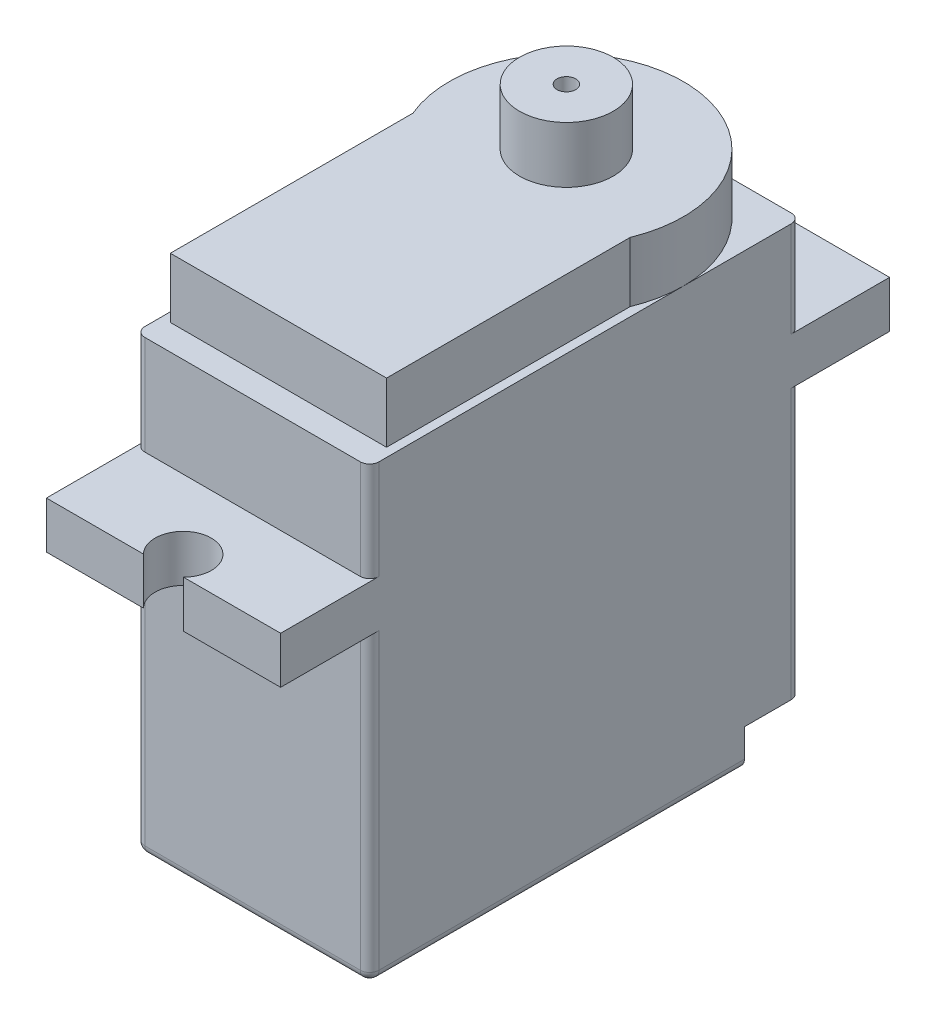
from build123d import *

# Parameters (mm, degrees)
SKETCH1_W               = 12.5
SKETCH1_H               = 23
BOSS_EXTRUDE1_DEPTH     = 24
BOSS_EXTRUDE2_DEPTH     = 3.2
SKETCH3_R               = 2.5
SKETCH3_R_2             = 0.5
BOSS_EXTRUDE3_DEPTH     = 3
SKETCH4_W               = 12.5
SKETCH4_H               = 2.5
BOSS_EXTRUDE4_DEPTH     = 4.75
SKETCH5_W               = 12.5
SKETCH5_H               = 2.5
BOSS_EXTRUDE5_DEPTH     = 4.75
CUT_EXTRUDE1_REACH      = 27.55
SKETCH6_R               = 1.5
CUT_EXTRUDE2_REACH      = 27.697
SKETCH8_R               = 1.5
CUT_EXTRUDE4_DEPTH      = 37.501404083
CUT_EXTRUDE6_DEPTH      = 37.501404083
CUT_EXTRUDE6_DEPTH_BACK = 2.3
CUT_EXTRUDE7_DEPTH      = 37.501404083
CUT_EXTRUDE7_DEPTH_BACK = 2.3
FILLET1_R               = 0.5


with BuildPart() as part:
    # Sketch1 → Boss-Extrude1 (new body)
    with BuildSketch(Plane(origin=(0, 0, 0), x_dir=(1, 0, 0), z_dir=(0, 1, 0))):
        Rectangle(SKETCH1_W, SKETCH1_H)
    extrude(amount=BOSS_EXTRUDE1_DEPTH)

    # Sketch2 → Boss-Extrude2 (add)
    with BuildSketch(Plane(origin=(0, 24, 0), x_dir=(1, 0, 0), z_dir=(0, 1, 0))):
        with BuildLine():
            Line((-5.757621024, 2.818477812), (-5.757621024, -10.12881992))
            Line((-5.757621024, -10.12881992), (5.781688552, -10.12881992))
            Line((5.781688552, -10.12881992), (5.781688552, 2.876273501))
            ThreePointArc((5.781688552, 2.876273501), (-0.031303305, 11.499921608), (-5.757621024, 2.818477812))
        make_face()
    extrude(amount=BOSS_EXTRUDE2_DEPTH)

    # Sketch3 → Boss-Extrude3 (add)
    with BuildSketch(Plane(origin=(0, 27.2, 0), x_dir=(1, 0, 0), z_dir=(0, 1, 0))):
        with Locations(Location((0, 5.25, 0), (0, 0, 270))):
            Circle(SKETCH3_R)
        with Locations(Location((0, 5.25, 0), (0, 0, 270))):
            Circle(SKETCH3_R_2, mode=Mode.SUBTRACT)
    extrude(amount=BOSS_EXTRUDE3_DEPTH)

    # Sketch4 → Boss-Extrude4 (add)
    with BuildSketch(Plane(origin=(0, 0, -11.5), x_dir=(-1, 0, 0), z_dir=(0, 0, -1))):
        with Locations((0, 17.65)):
            Rectangle(SKETCH4_W, SKETCH4_H)
    extrude(amount=BOSS_EXTRUDE4_DEPTH)

    # Sketch5 → Boss-Extrude5 (add)
    with BuildSketch(Plane.XY.offset(11.5)):
        with Locations((0, 17.45)):
            Rectangle(SKETCH5_W, SKETCH5_H)
    extrude(amount=BOSS_EXTRUDE5_DEPTH)

    # Sketch6 → Cut-Extrude1 (cut, up to next)
    with BuildSketch(Plane(origin=(0, 18.7, 0), x_dir=(1, 0, 0), z_dir=(0, 1, 0)), mode=Mode.PRIVATE) as cut_extrude1_sk1:
        with Locations((0, -15.2)):
            Circle(SKETCH6_R)
    cut_extrude1_tool1 = extrude(cut_extrude1_sk1.sketch, amount=-CUT_EXTRUDE1_REACH, mode=Mode.PRIVATE) & part.part
    add(cut_extrude1_tool1.solids().sort_by_distance((0, 18.7, 15.2))[0], mode=Mode.SUBTRACT)

    # Sketch8 → Cut-Extrude2 (cut, up to next)
    with BuildSketch(Plane(origin=(0, 18.9, 0), x_dir=(1, 0, 0), z_dir=(0, 1, 0)), mode=Mode.PRIVATE) as cut_extrude2_sk1:
        with Locations((0, 15.2)):
            Circle(SKETCH8_R)
    cut_extrude2_tool1 = extrude(cut_extrude2_sk1.sketch, amount=-CUT_EXTRUDE2_REACH, mode=Mode.PRIVATE) & part.part
    add(cut_extrude2_tool1.solids().sort_by_distance((0, 18.9, -15.2))[0], mode=Mode.SUBTRACT)

    # Sketch9 → Cut-Extrude4 (cut, through all)
    with BuildSketch(Plane(origin=(6.25, 0, 0), x_dir=(0, 0, -1), z_dir=(1, 0, 0))):
        Polygon((11.5, 2), (8.5, 0), (11.5, 0), align=None)
    extrude(amount=-CUT_EXTRUDE4_DEPTH, mode=Mode.SUBTRACT)

    # Sketch10 → Cut-Extrude6 (cut, two sides: drawn at the far end of the back side and taken through both)
    with BuildSketch(Plane(origin=(6.25, 0, 0), x_dir=(0, 0, -1), z_dir=(1, 0, 0)).offset(-CUT_EXTRUDE6_DEPTH_BACK)):
        Polygon((100.627808007, 2), (11.5, 2), (8.5, 2), (8.5, 0), (8.5, -89.127808007), (133.856074627, -215.859489897), (225.983882634, -124.73168189), align=None)
    extrude(amount=CUT_EXTRUDE6_DEPTH + CUT_EXTRUDE6_DEPTH_BACK, mode=Mode.SUBTRACT)

    # Sketch11 → Cut-Extrude7 (cut, two sides: drawn at the far end of the back side and taken through both)
    with BuildSketch(Plane.ZY.offset(6.25).offset(-CUT_EXTRUDE7_DEPTH_BACK)):
        Polygon((-100.627808007, 2), (-11.5, 2), (-8.5, 2), (-8.5, 0), (-8.5, -89.127808007), (-133.856074627, -215.859489897), (-225.983882634, -124.73168189), align=None)
    extrude(amount=CUT_EXTRUDE7_DEPTH + CUT_EXTRUDE7_DEPTH_BACK, mode=Mode.SUBTRACT)

    # Fillet1
    fillet1_edges = [part.edges().sort_by_distance(p)[0] for p in [
        (-6.25, 9.2, -11.5),
        (6.25, 9.2, -11.5),
        (6.25, 0, 1.5),
        (6.25, 8.1, 11.5),
        (-6.25, 8.1, 11.5),
        (0, 0, 11.5),
        (-6.25, 21.45, -11.5),
        (6.25, 21.45, -11.5),
        (6.25, 21.35, 11.5),
        (-6.25, 21.35, 11.5),
        (-6.25, 0, 1.5),
    ]]
    fillet(fillet1_edges, radius=FILLET1_R)


solid = part.part
